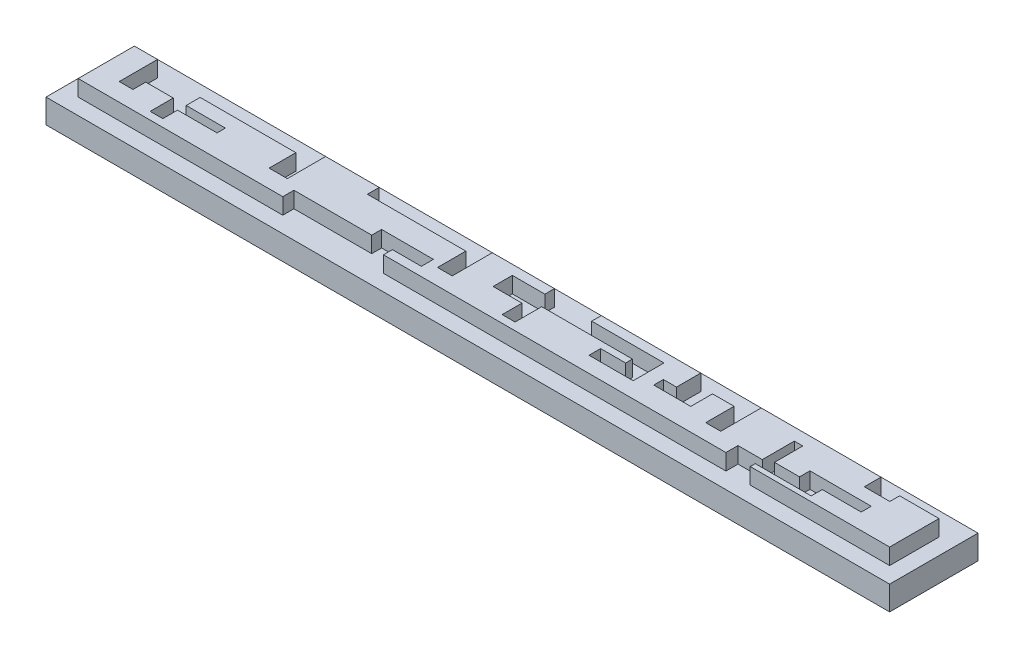
from build123d import *

# Parameters (mm, degrees)
SKETCH_1_W          = 52.5
SKETCH_1_H          = 5.5
EXTRUDE_1_DEPTH     = 1.5
SKETCH_2_W          = 50.5
SKETCH_2_H          = 3.5
EXTRUDE_2_DEPTH     = 1
CUT_EXTRUDE_1_DEPTH = 1


with BuildPart() as part:
    # 草图1 → 凸台-拉伸1 (new body)
    with BuildSketch(Plane(origin=(0, 0, 0), x_dir=(1, 0, 0), z_dir=(0, 1, 0))):
        with Locations((26.25, -2.75)):
            Rectangle(SKETCH_1_W, SKETCH_1_H)
    extrude(amount=EXTRUDE_1_DEPTH)

    # 草图2 → 凸台-拉伸2 (add)
    with BuildSketch(Plane(origin=(0, 1.5, 0), x_dir=(1, 0, 0), z_dir=(0, 1, 0))):
        with Locations((26.25, -2.75)):
            Rectangle(SKETCH_2_W, SKETCH_2_H)
    extrude(amount=EXTRUDE_2_DEPTH)

    # 草图3 → 切除-拉伸1 (cut)
    with BuildSketch(Plane(origin=(0, 2.5, 0), x_dir=(1, 0, 0), z_dir=(0, 1, 0))):
        Polygon((2.441285036, -1), (2.441285036, -3.385807874), (3.297792845, -3.385807874), (3.297792845, -2.590222366), (5.010808462, -2.590222366), (5.010808462, -4.02818873), (5.797531803, -4.02818873), (5.797531803, -3.110546333), (8.253302308, -3.110546333), (8.253302308, -2.590222366), (5.813610605, -2.590222366), (5.813610605, -1.721967074), (11.771102235, -1.721967074), (11.771102235, -3.385807874), (12.90419018, -3.385807874), (12.90419018, -1), align=None)
        Polygon((13.734934002, -4.5), (13.734934002, -3.806276904), (18.57720237, -3.806276904), (18.57720237, -3.191075541), (21.800907432, -3.191075541), (21.800907432, -3.942903937), (20.000873813, -3.942903937), (20.000873813, -4.5), align=None)
        Polygon((16.237613485, -1), (16.237613485, -1.73768688), (22.365277211, -1.73768688), (22.365277211, -3.5), (23.277541754, -3.5), (23.277541754, -1), align=None)
        Polygon((25.11928338, -1.598265318), (25.11928338, -2.796313913), (26.916272405, -2.796313913), (26.916272405, -4.02818873), (27.721819209, -4.02818873), (27.721819209, -2.371232168), (33.367210511, -2.371232168), (33.367210511, -2.796313913), (31.81151837, -2.796313913), (31.81151837, -3.519184621), (34.558639523, -3.519184621), (34.558639523, -1.598265318), (30.055839437, -1.598265318), (30.055839437, -1), (27.143477914, -1), (27.143477914, -1.598265318), align=None)
        Polygon((36.247190267, -1), (36.247190267, -2.51018455), (35.430902313, -2.51018455), (35.430902313, -3.110546333), (37.734000469, -3.110546333), (37.734000469, -1.755092275), (39.075044965, -1.755092275), (39.075044965, -3.519184621), (40.007945484, -3.519184621), (40.007945484, -1.42807574), (40.007945484, -1), align=None)
        Polygon((41.31314972, -4.5), (41.31314972, -3.749200991), (42.825396523, -3.749200991), (42.825396523, -1.755092275), (43.353482708, -1.755092275), (43.353482708, -3.519184621), (44.913737346, -3.519184621), (44.913737346, -2.873049456), (48.730360229, -2.873049456), (48.730360229, -3.5), (46.305964561, -3.5), (46.305964561, -4.185040027), (42.825396523, -4.185040027), (42.825396523, -4.5), align=None)
        Polygon((47.464486029, -1), (47.464486029, -2.039438327), (49.049976505, -2.039438327), (49.049976505, -1.42807574), (51.5, -1.42807574), (51.5, -1), align=None)
    extrude(amount=-CUT_EXTRUDE_1_DEPTH, mode=Mode.SUBTRACT)


solid = part.part
